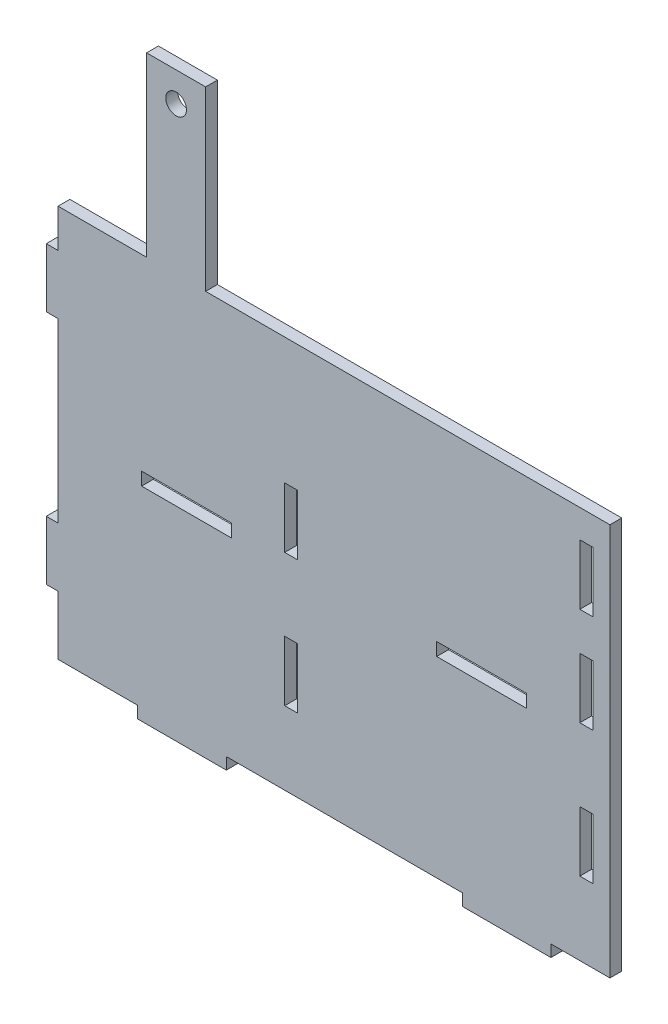
from build123d import *

# Parameters (mm, degrees)
SKETCH_1_W      = 4.4
SKETCH_1_H      = 20.4
SKETCH_1_W_2    = 30.4
SKETCH_1_H_2    = 4.4
SKETCH_1_R      = 3.5
EXTRUDE_1_DEPTH = 4


with BuildPart() as part:
    # Эскиз1 → Бобышка-Вытянуть1 (new body)
    with BuildSketch(Plane.XY):
        Polygon((0, 20), (0, 0), (27, 0), (27, -4), (57, -4), (57, 0), (137, 0), (137, -4), (167, -4), (167, 0), (187, 0), (187, 133), (50, 133), (50, 193), (30, 193), (30, 133), (0, 133), (0, 120), (-4, 120), (-4, 100), (0, 100), (0, 40), (-4, 40), (-4, 20), align=None)
        with Locations((79, 35)):
            Rectangle(SKETCH_1_W, SKETCH_1_H, mode=Mode.SUBTRACT)
        with Locations((43.5, 67.2)):
            Rectangle(SKETCH_1_W_2, SKETCH_1_H_2, mode=Mode.SUBTRACT)
        with Locations((79, 80)):
            Rectangle(SKETCH_1_W, SKETCH_1_H, mode=Mode.SUBTRACT)
        with Locations((179, 35)):
            Rectangle(SKETCH_1_W, SKETCH_1_H, mode=Mode.SUBTRACT)
        with Locations((143.5, 67.2)):
            Rectangle(SKETCH_1_W_2, SKETCH_1_H_2, mode=Mode.SUBTRACT)
        with Locations((179, 80)):
            Rectangle(SKETCH_1_W, SKETCH_1_H, mode=Mode.SUBTRACT)
        with Locations((179, 113.3)):
            Rectangle(SKETCH_1_W, SKETCH_1_H, mode=Mode.SUBTRACT)
        with Locations((40, 183)):
            Circle(SKETCH_1_R, mode=Mode.SUBTRACT)
    extrude(amount=EXTRUDE_1_DEPTH)


solid = part.part
